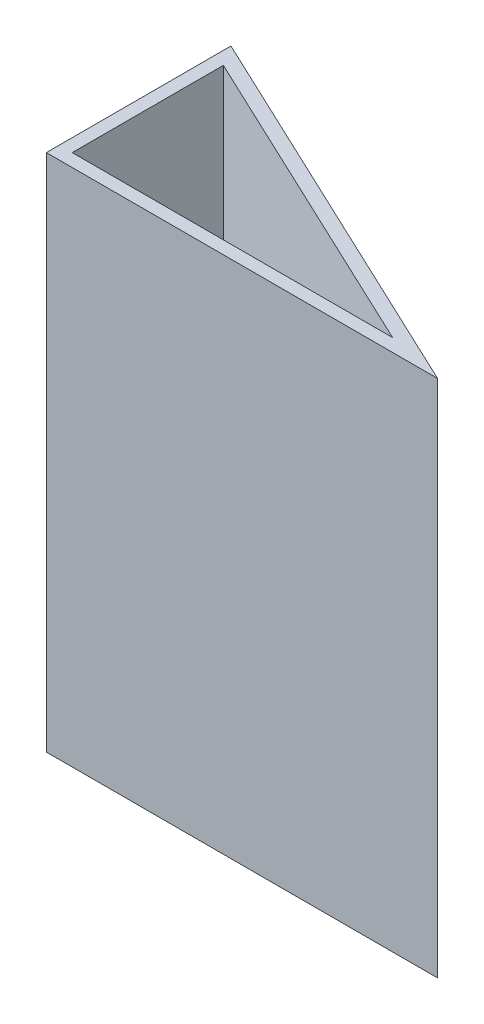
from build123d import *

# Parameters (mm, degrees)
BOSS_EXTRUDE1_DEPTH = 114.3
CUT_EXTRUDE1_DEPTH  = 114.3


with BuildPart() as part:
    # Sketch1 → Boss-Extrude1 (new body)
    with BuildSketch(Plane(origin=(0, 0, 0), x_dir=(1, 0, 0), z_dir=(0, 1, 0))):
        Polygon((-17.460176096, 2.474651476), (-17.460176096, -38.165677622), (68.684621489, -38.165677622), align=None)
    extrude(amount=BOSS_EXTRUDE1_DEPTH)

    # Sketch2 → Cut-Extrude1 (cut)
    with BuildSketch(Plane(origin=(0, 114.3, 0), x_dir=(1, 0, 0), z_dir=(0, 1, 0))):
        Polygon((-14.606511496, -2.046877622), (-14.606511496, -35.320877622), (55.92531835, -35.320877622), align=None)
    extrude(amount=-CUT_EXTRUDE1_DEPTH, mode=Mode.SUBTRACT)


solid = part.part
